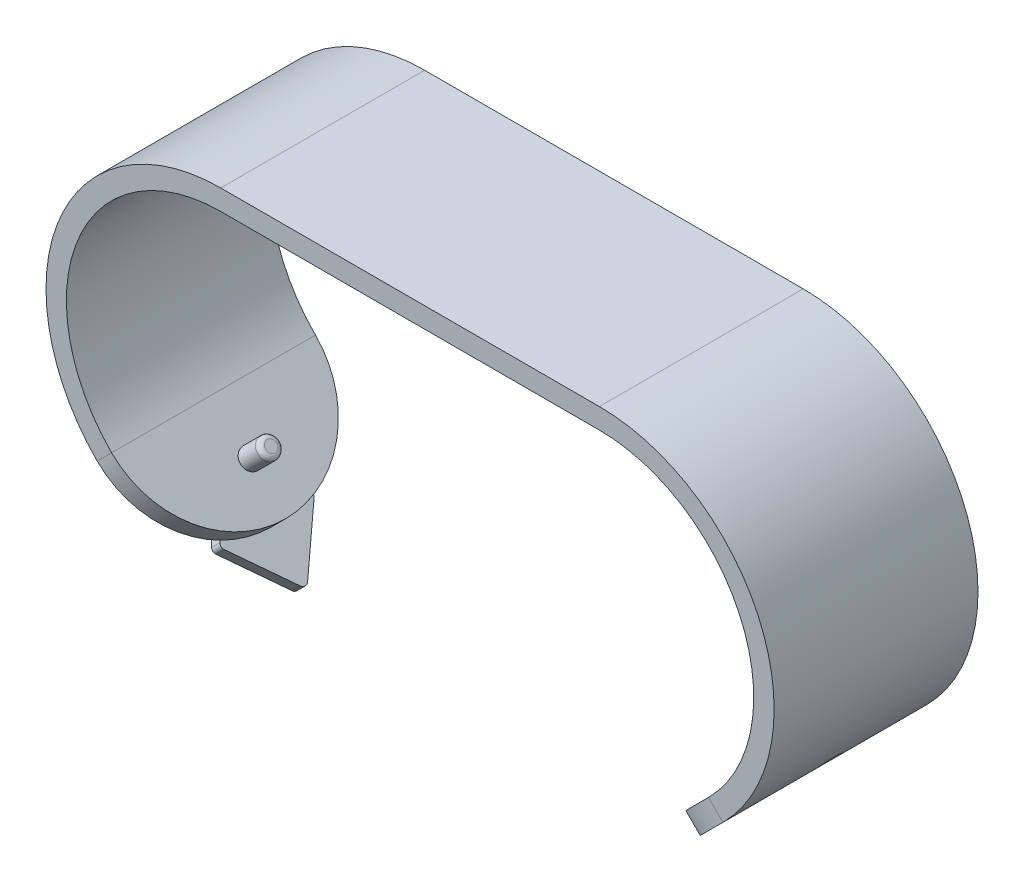
from build123d import *

# Parameters (mm, degrees)
BOSS_EXTRUDE1_DEPTH = 35
BOSS_EXTRUDE2_DEPTH = 3.5
BOSS_EXTRUDE3_DEPTH = 2
CUT_EXTRUDE2_DEPTH  = 0.5
FILLET1_R           = 0.8
SKETCH5_R           = 1.75
BOSS_EXTRUDE4_DEPTH = 5
FILLET2_R           = 0.8
SKETCH6_R           = 2.5
CUT_EXTRUDE4_DEPTH  = 128.140994275


with BuildPart() as part:
    # Sketch1 → Boss-Extrude1 (new body)
    with BuildSketch(Plane.XY):
        with BuildLine():
            ThreePointArc((32.5, 3.5), (60.216385975, -15.019497029), (53.713203436, -47.713203436))
            Line((53.713203436, -47.713203436), (51.238329701, -45.238329701))
            ThreePointArc((51.238329701, -45.238329701), (56.982807612, -16.358889042), (32.5, 0))
            Line((32.5, 0), (-32.5, 0))
            ThreePointArc((-32.5, 0), (-56.982807612, -16.358889042), (-51.238329701, -45.238329701))
            Line((-51.238329701, -45.238329701), (-53.713203436, -47.713203436))
            ThreePointArc((-53.713203436, -47.713203436), (-60.216385975, -15.019497029), (-32.5, 3.5))
            Line((-32.5, 3.5), (32.5, 3.5))
        make_face()
    extrude(amount=BOSS_EXTRUDE1_DEPTH)

    # Sketch2 → Boss-Extrude2 (add)
    with BuildSketch(Plane(origin=(-50.713203436, -50.713203436, 0), x_dir=(0, 0, 1), z_dir=(-0.7071067811865488, -0.7071067811865464, 0))):
        with BuildLine():
            Line((35, 4.242640687), (0, 4.242640687))
            ThreePointArc((0, 4.242640687), (17.5, -13.257359313), (35, 4.242640687))
        make_face()
    boss_extrude2 = extrude(amount=-BOSS_EXTRUDE2_DEPTH)

    # Mirror1: Boss-Extrude2 across plane
    add(boss_extrude2.mirror(Plane(origin=(0, 0, 0), x_dir=(0, 0, 1), z_dir=(1, 0, 0))))

    # Sketch3 → Boss-Extrude3 (add)
    with BuildSketch(Plane(origin=(-50.713203436, -50.713203436, 0), x_dir=(0, 0, 1), z_dir=(-0.7071067811865487, -0.7071067811865465, 0))):
        Polygon((17.502560815, -0.889154327), (9.378087293, -12.279246125), (17.502560815, -21.961616632), (25.627034337, -12.279246125), align=None)
    extrude(amount=BOSS_EXTRUDE3_DEPTH)

    # Sketch4 → Cut-Extrude2 (cut)
    with BuildSketch(Plane(origin=(-52.127416998, -52.127416998, 0), x_dir=(0, 0, 1), z_dir=(-0.7071067811865486, -0.7071067811865465, 0))):
        Polygon((11.432409465, -11.094265864), (17.402560815, -9.038577899), (17.402560815, -2.724422361), align=None)
        Polygon((17.602560815, -9.038577899), (23.572712164, -11.094265864), (17.602560815, -2.724422361), align=None)
        Polygon((17.402560815, -9.250102035), (11.40902714, -11.31384118), (17.402560815, -14.36769912), align=None)
        Polygon((17.602560815, -14.36769912), (23.59609449, -11.31384118), (17.602560815, -9.250102035), align=None)
        Polygon((17.402560815, -15.714490605), (11.524861695, -12.719653319), (17.402560815, -19.724422361), align=None)
        Polygon((17.602560815, -19.724422361), (23.480259935, -12.719653319), (17.602560815, -15.714490605), align=None)
    extrude(amount=-CUT_EXTRUDE2_DEPTH, mode=Mode.SUBTRACT)

    # Fillet1
    fillet1_edges = [part.edges().sort_by_distance(p)[0] for p in [
        (-42.737572014, -60.103048419, 25.627034337),
        (-50.791583162, -52.049037271, 17.502560815),
        (-42.737572014, -60.103048419, 9.378087293),
        (-35.89110217, -66.949518263, 17.502560815),
    ]]
    fillet(fillet1_edges, radius=FILLET1_R)

    # Sketch5 → Boss-Extrude4 (add)
    with BuildSketch(Plane(origin=(-48.238329701, -48.238329701, 0), x_dir=(0, 0, -1), z_dir=(0.7071067811865487, 0.7071067811865465, 0))):
        with Locations(Location((-17.5, -4.757359313, 0), (0, 0, 90))):
            Circle(SKETCH5_R)
    extrude(amount=BOSS_EXTRUDE4_DEPTH)

    # Fillet2
    fillet2_edges = [part.edges().sort_by_distance(p)[0] for p in [
        (-40.101397898, -49.304193693, 17.5),
    ]]
    fillet(fillet2_edges, radius=FILLET2_R)

    # Sketch6 → Cut-Extrude4 (cut, through all)
    with BuildSketch(Plane(origin=(48.238329701, -48.238329701, 0), x_dir=(0, 0, 1), z_dir=(-0.7071067811865487, 0.7071067811865465, 0))):
        with Locations((17.5, 4.242640687)):
            Circle(SKETCH6_R)
    extrude(amount=-CUT_EXTRUDE4_DEPTH, mode=Mode.SUBTRACT)


solid = part.part
